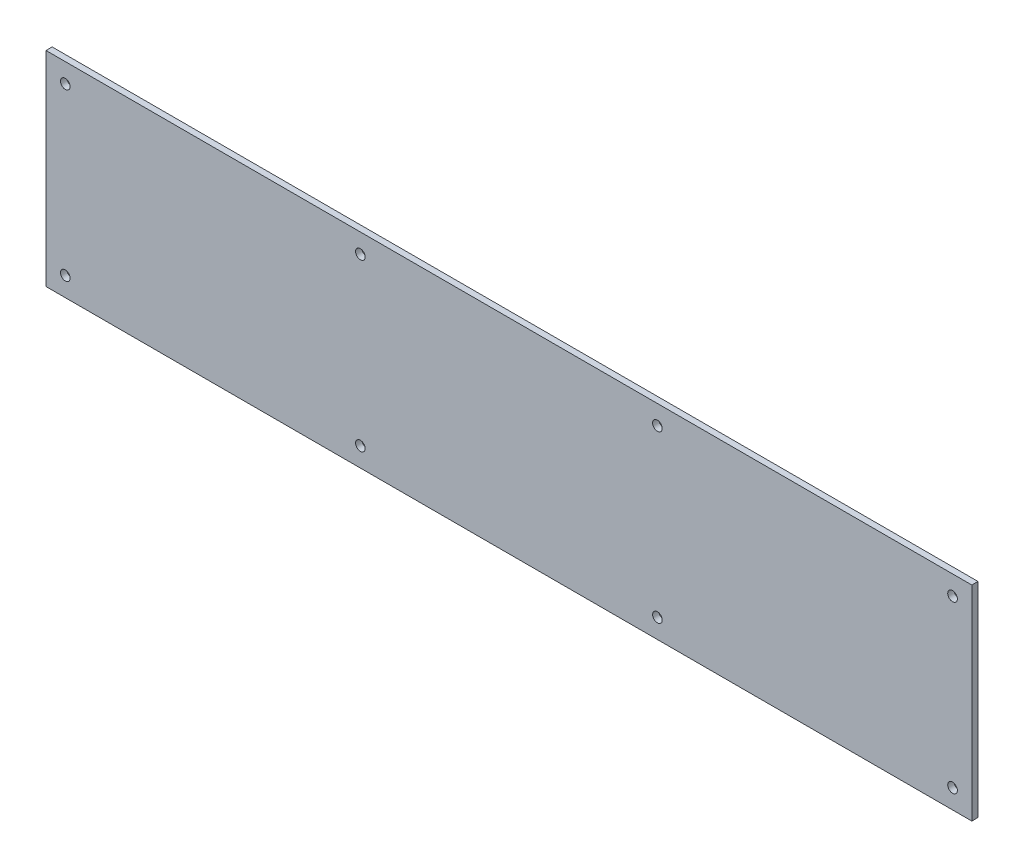
from build123d import *

# Parameters (mm, degrees)
SKETCH1_W          = 304.8
SKETCH1_H          = 67.31
EXTRUDE1_DEPTH     = 2.032
SKETCH2_R          = 1.5875
CUT_EXTRUDE1_DEPTH = 382.005418628


with BuildPart() as part:
    # Sketch1 → Extrude1 (new body)
    with BuildSketch(Plane.XY):
        with Locations((-152.4, 194.945)):
            Rectangle(SKETCH1_W, SKETCH1_H)
    extrude(amount=EXTRUDE1_DEPTH)

    # Sketch2 → Cut-Extrude1 (cut, through all)
    with BuildSketch(Plane.XY.offset(2.032)):
        with Locations((-201.295, 222.25)):
            Circle(SKETCH2_R)
        with Locations((-298.45, 222.25)):
            Circle(SKETCH2_R)
        with Locations((-298.45, 167.64)):
            Circle(SKETCH2_R)
        with Locations((-201.295, 167.64)):
            Circle(SKETCH2_R)
        with Locations(Location((-103.505, 167.64, 0), (0, 0, 180))):
            Circle(SKETCH2_R)
        with Locations(Location((-6.35, 167.64, 0), (0, 0, 180))):
            Circle(SKETCH2_R)
        with Locations(Location((-6.35, 222.25, 0), (0, 0, 180))):
            Circle(SKETCH2_R)
        with Locations(Location((-103.505, 222.25, 0), (0, 0, 180))):
            Circle(SKETCH2_R)
    extrude(amount=-CUT_EXTRUDE1_DEPTH, mode=Mode.SUBTRACT)


solid = part.part
